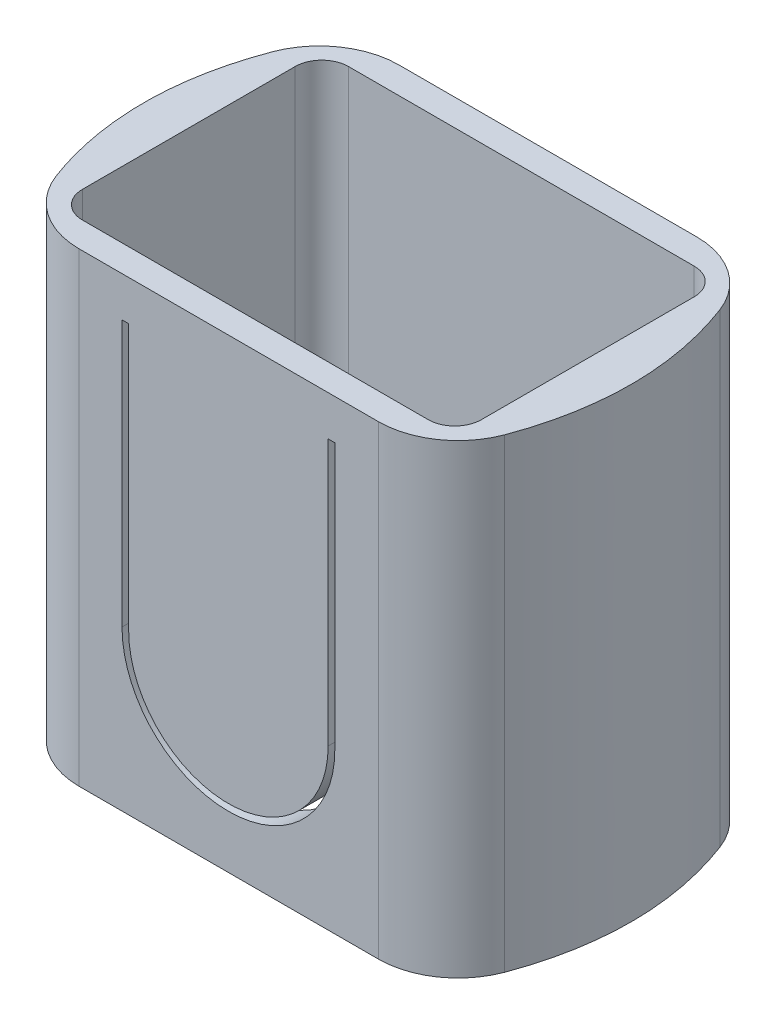
from build123d import *

# Parameters (mm, degrees)
BOSS_EXTRUDE4_DEPTH = 80
BOSS_EXTRUDE5_DEPTH = 57
CUT_EXTRUDE1_DEPTH  = 3
SKETCH13_W          = 46.599854234
SKETCH13_H          = 36.724502986
CUT_EXTRUDE2_DEPTH  = 45


with BuildPart() as part:
    # Sketch8 → Boss-Extrude4 (new body)
    with BuildSketch(Plane(origin=(0, 58, 0), x_dir=(1, 0, 0), z_dir=(0, 1, 0))):
        with BuildLine():
            Line((-11.242998334, -12), (11.242998334, -12))
            ThreePointArc((11.242998334, -12), (14.65898123, -10.932652517), (16.859617211, -8.110353618))
            add(Edge.make_bspline(
                [(16.859617211, -8.110353618), (17.850691543, -5.472650271), (18.834301198, 0.028433299), (17.819526576, 5.426475932), (16.811684839, 8.109721769)],
                knots=[0.167422492, 0.167422492, 0.167422492, 0.167422492, 0.502499344, 0.837905074, 0.837905074, 0.837905074, 0.837905074], degree=3))
            ThreePointArc((16.811684839, 8.109721769), (14.611088933, 10.932460371), (11.194828596, 12))
            Line((11.194828596, 12), (-11.194828596, 12))
            ThreePointArc((-11.194828596, 12), (-14.611088933, 10.932460371), (-16.811684839, 8.109721769))
            add(Edge.make_bspline(
                [(-16.859617211, -8.110353618), (-17.850691543, -5.472650271), (-18.834301198, 0.028433299), (-17.819526576, 5.426475932), (-16.811684839, 8.109721769)],
                knots=[0.167422492, 0.167422492, 0.167422492, 0.167422492, 0.502499344, 0.837905074, 0.837905074, 0.837905074, 0.837905074], degree=3))
            ThreePointArc((-16.859617211, -8.110353618), (-14.65898123, -10.932652517), (-11.242998334, -12))
        make_face()
        with BuildLine():
            Line((-13, -10), (13, -10))
            ThreePointArc((13, -10), (14.414213562, -9.414213562), (15, -8))
            Line((15, -8), (15, 8))
            ThreePointArc((15, 8), (14.414213562, 9.414213562), (13, 10))
            Line((13, 10), (-13, 10))
            ThreePointArc((-13, 10), (-14.414213562, 9.414213562), (-15, 8))
            Line((-15, 8), (-15, -8))
            ThreePointArc((-15, -8), (-14.414213562, -9.414213562), (-13, -10))
        make_face(mode=Mode.SUBTRACT)
    extrude(amount=BOSS_EXTRUDE4_DEPTH)

    # Sketch11 → Boss-Extrude5 (add)
    with BuildSketch(Plane(origin=(0, 58, 0), x_dir=(1, 0, 0), z_dir=(0, 1, 0))):
        with BuildLine():
            Line((13, 10), (15, 10))
            Line((15, 10), (15, 6.937911183))
            Line((15, 6.937911183), (13.5, 6.937911183))
            ThreePointArc((13.5, 6.937911183), (13.146446609, 7.084357793), (13, 7.437911183))
            Line((13, 7.437911183), (13, 10))
        make_face()
        with BuildLine():
            Line((-13, 7.437911183), (-13, 10))
            Line((-13, 10), (-15, 10))
            Line((-15, 10), (-15, 6.937911183))
            Line((-15, 6.937911183), (-13.5, 6.937911183))
            ThreePointArc((-13.5, 6.937911183), (-13.146446609, 7.084357793), (-13, 7.437911183))
        make_face()
    extrude(amount=BOSS_EXTRUDE5_DEPTH)

    # Sketch12 → Cut-Extrude1 (cut)
    with BuildSketch(Plane.XY.offset(12)):
        with BuildLine():
            Line((7.476357736, 134.986611492), (7.476357736, 114.986611492))
            ThreePointArc((7.476357736, 114.986611492), (-0.023642264, 107.486611492), (-7.523642264, 114.986611492))
            Line((-7.523642264, 114.986611492), (-7.523642264, 134.986611492))
            Line((-7.523642264, 134.986611492), (-8.023642264, 134.986611492))
            Line((-8.023642264, 134.986611492), (-8.023642264, 114.986611492))
            ThreePointArc((-8.023642264, 114.986611492), (-0.023642264, 106.986611492), (7.976357736, 114.986611492))
            Line((7.976357736, 114.986611492), (7.976357736, 134.986611492))
            Line((7.976357736, 134.986611492), (7.476357736, 134.986611492))
        make_face()
    extrude(amount=-CUT_EXTRUDE1_DEPTH, mode=Mode.SUBTRACT)

    # Sketch13 → Cut-Extrude2 (cut)
    with BuildSketch(Plane(origin=(0, 58, 0), x_dir=(1, 0, 0), z_dir=(0, 1, 0))):
        with Locations((3.699497448, 5.974004227)):
            Rectangle(SKETCH13_W, SKETCH13_H)
    extrude(amount=CUT_EXTRUDE2_DEPTH, mode=Mode.SUBTRACT)


solid = part.part
